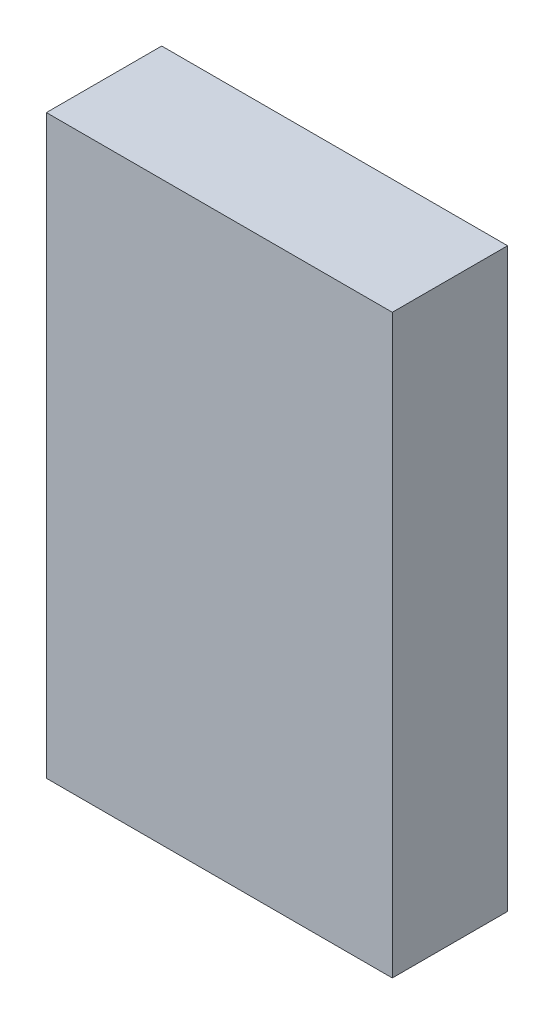
from build123d import *

# Parameters (mm, degrees)
SKETCH_1_W      = 3
SKETCH_1_H      = 5
EXTRUDE_1_DEPTH = 1


with BuildPart() as part:
    # Эскиз1 → Бобышка-Вытянуть1 (new body)
    with BuildSketch(Plane.XY):
        Rectangle(SKETCH_1_W, SKETCH_1_H)
    extrude(amount=EXTRUDE_1_DEPTH)


solid = part.part
